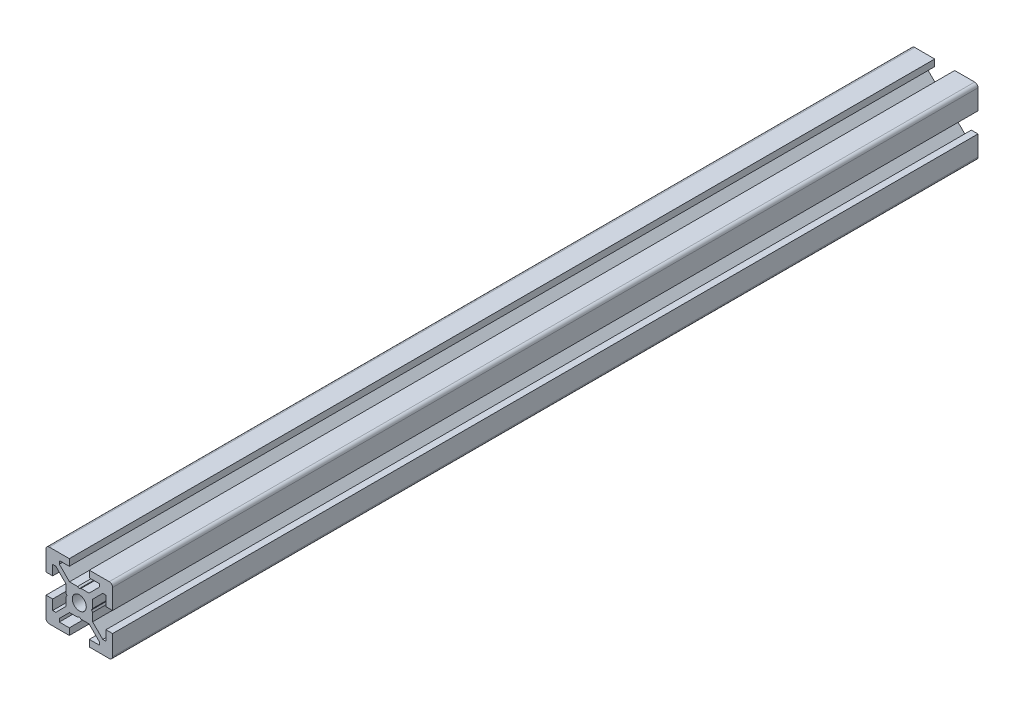
from build123d import *

# Parameters (mm, degrees)
MODEL_R         = 2.1
EXTRUDE_1_DEPTH = 260


with BuildPart() as part:
    # Model → 보스-돌출1 (new body)
    with BuildSketch(Plane.XY):
        with BuildLine():
            Line((-10, 3), (-8, 3))
            Line((-8, 3), (-8, 6))
            Line((-8, 6), (-7.060660172, 6))
            Line((-7.060660172, 6), (-4, 2.939339828))
            Line((-4, 2.939339828), (-4, 0.519615242))
            Line((-4, 0.519615242), (-3.7, 0))
            Line((-3.7, 0), (-4, -0.519615242))
            Line((-4, -0.519615242), (-4, -2.939339828))
            Line((-4, -2.939339828), (-7.060660172, -6))
            Line((-7.060660172, -6), (-8, -6))
            Line((-8, -6), (-8, -3))
            Line((-8, -3), (-10, -3))
            Line((-10, -3), (-10, -9))
            ThreePointArc((-10, -9), (-9.707106781, -9.707106781), (-9, -10))
            Line((-9, -10), (-3, -10))
            Line((-3, -10), (-3, -8))
            Line((-3, -8), (-6, -8))
            Line((-6, -8), (-6, -7.060660172))
            Line((-6, -7.060660172), (-2.939339828, -4))
            Line((-2.939339828, -4), (-0.519615242, -4))
            Line((-0.519615242, -4), (0, -3.7))
            Line((0, -3.7), (0.519615242, -4))
            Line((0.519615242, -4), (2.939339828, -4))
            Line((2.939339828, -4), (6, -7.060660172))
            Line((6, -7.060660172), (6, -8))
            Line((6, -8), (3, -8))
            Line((3, -8), (3, -10))
            Line((3, -10), (9, -10))
            ThreePointArc((9, -10), (9.707106781, -9.707106781), (10, -9))
            Line((10, -9), (10, -3))
            Line((10, -3), (8, -3))
            Line((8, -3), (8, -6))
            Line((8, -6), (7.060660172, -6))
            Line((7.060660172, -6), (4, -2.939339828))
            Line((4, -2.939339828), (4, -0.519615242))
            Line((4, -0.519615242), (3.7, 0))
            Line((3.7, 0), (4, 0.519615242))
            Line((4, 0.519615242), (4, 2.939339828))
            Line((4, 2.939339828), (7.060660172, 6))
            Line((7.060660172, 6), (8, 6))
            Line((8, 6), (8, 3))
            Line((8, 3), (10, 3))
            Line((10, 3), (10, 9))
            ThreePointArc((10, 9), (9.707106781, 9.707106781), (9, 10))
            Line((9, 10), (3, 10))
            Line((3, 10), (3, 8))
            Line((3, 8), (6, 8))
            Line((6, 8), (6, 7.060660172))
            Line((6, 7.060660172), (2.939339828, 4))
            Line((2.939339828, 4), (0.519615242, 4))
            Line((0.519615242, 4), (0, 3.7))
            Line((0, 3.7), (-0.519615242, 4))
            Line((-0.519615242, 4), (-2.939339828, 4))
            Line((-2.939339828, 4), (-6, 7.060660172))
            Line((-6, 7.060660172), (-6, 8))
            Line((-6, 8), (-3, 8))
            Line((-3, 8), (-3, 10))
            Line((-3, 10), (-9, 10))
            ThreePointArc((-9, 10), (-9.707106781, 9.707106781), (-10, 9))
            Line((-10, 9), (-10, 3))
        make_face()
        Circle(MODEL_R, mode=Mode.SUBTRACT)
    extrude(amount=EXTRUDE_1_DEPTH)


solid = part.part
